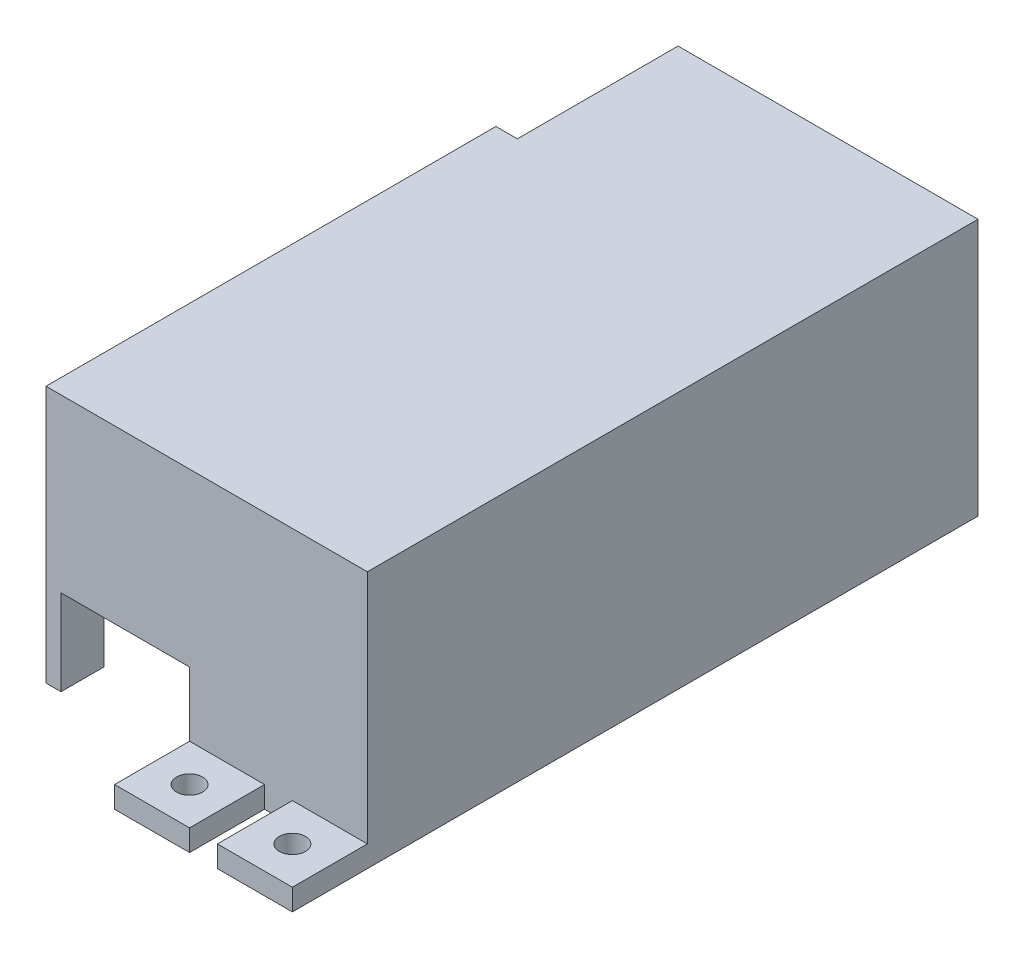
from build123d import *

# Parameters (mm, degrees)
BOSS_EXTRUDE1_DEPTH = 30.48
SHELL1_T            = -1.778
CUT_EXTRUDE3_REACH  = 89.298
SKETCH7_W           = 15.24
SKETCH7_H           = 10.16
SKETCH2_W           = 8.89
SKETCH2_H           = 2.54
BOSS_EXTRUDE2_DEPTH = 8.89
SKETCH3_R           = 1.55
CUT_EXTRUDE1_DEPTH  = 87.444003262
SKETCH4_R           = 1.55
CUT_EXTRUDE2_DEPTH  = 87.444003262
SKETCH8_W           = 43.18
SKETCH8_H           = 22.86
CUT_EXTRUDE4_DEPTH  = 11.684


with BuildPart() as part:
    # Sketch1 → Boss-Extrude1 (new body)
    with BuildSketch(Plane(origin=(0, 0, 0), x_dir=(1, 0, 0), z_dir=(0, 1, 0))):
        Polygon((0, 0), (38.1, 0), (38.1, 53.34), (38.1, 72.39), (2.54, 72.39), (2.54, 53.34), (0, 53.34), align=None)
    extrude(amount=BOSS_EXTRUDE1_DEPTH)

    # Shell1
    shell1_openings = [part.faces().sort_by_distance(p)[0] for p in [
        (19.3675, 0, -35.71875),
    ]]
    offset(amount=SHELL1_T, openings=shell1_openings, kind=Kind.INTERSECTION)

    # Sketch7 → Cut-Extrude3 (cut, up to next)
    with BuildSketch(Plane.XY, mode=Mode.PRIVATE) as cut_extrude3_sk1:
        with Locations((9.398, 5.08)):
            Rectangle(SKETCH7_W, SKETCH7_H)
    cut_extrude3_tool1 = extrude(cut_extrude3_sk1.sketch, amount=-CUT_EXTRUDE3_REACH, mode=Mode.PRIVATE) & part.part
    add(cut_extrude3_tool1.solids().sort_by_distance((9.398, 5.08, 0))[0], mode=Mode.SUBTRACT)

    # Sketch2 → Boss-Extrude2 (add)
    with BuildSketch(Plane.XY):
        with Locations((21.463, 1.27)):
            Rectangle(SKETCH2_W, SKETCH2_H)
        with Locations((33.655, 1.27)):
            Rectangle(SKETCH2_W, SKETCH2_H)
    extrude(amount=BOSS_EXTRUDE2_DEPTH)

    # Sketch3 → Cut-Extrude1 (cut, through all)
    with BuildSketch(Plane(origin=(0, 2.54, 0), x_dir=(1, 0, 0), z_dir=(0, 1, 0))):
        with Locations(Location((21.463, -4.445, 0), (0, 0, 270))):
            Circle(SKETCH3_R)
    extrude(amount=-CUT_EXTRUDE1_DEPTH, mode=Mode.SUBTRACT)

    # Sketch4 → Cut-Extrude2 (cut, through all)
    with BuildSketch(Plane(origin=(0, 2.54, 0), x_dir=(1, 0, 0), z_dir=(0, 1, 0))):
        with Locations(Location((33.655, -4.445, 0), (0, 0, 180))):
            Circle(SKETCH4_R)
    extrude(amount=-CUT_EXTRUDE2_DEPTH, mode=Mode.SUBTRACT)

    # Sketch8 → Cut-Extrude4 (cut)
    with BuildSketch(Plane.ZY):
        with Locations((-26.67, 11.43)):
            Rectangle(SKETCH8_W, SKETCH8_H)
    extrude(amount=-CUT_EXTRUDE4_DEPTH, mode=Mode.SUBTRACT)


solid = part.part
